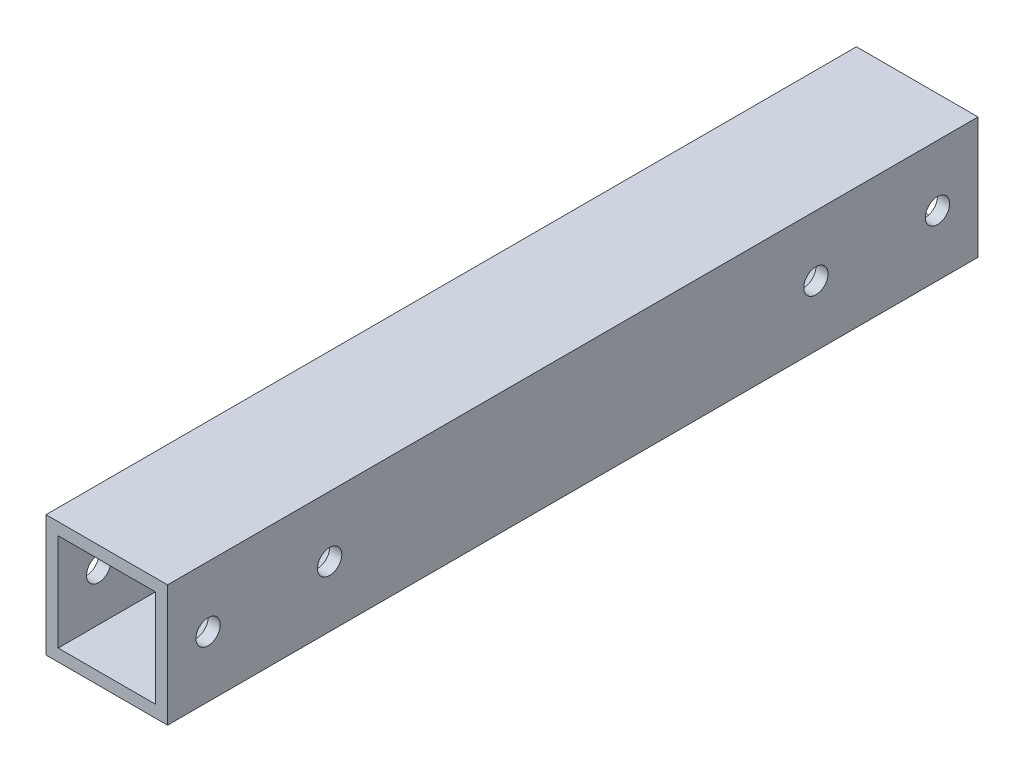
from build123d import *

# Parameters (mm, degrees)
ESQUISSE1_W             = 15
ESQUISSE1_H             = 15
EXTRUSION1_DEPTH        = 100
ESQUISSE2_W             = 12
ESQUISSE2_H             = 12
EXTRUSION2_DEPTH        = 101.560926806
ESQUISSE3_R             = 1.5
ENL_V_MAT_EXTRU_1_DEPTH = 102.396498953
ESQUISSE4_R             = 1.5
ENL_V_MAT_EXTRU_2_DEPTH = 102.396498953
ESQUISSE5_R             = 1.5
ENL_V_MAT_EXTRU_3_DEPTH = 102.396498953


with BuildPart() as part:
    # Esquisse1 → Extrusion1 (new body)
    with BuildSketch(Plane.XY):
        Rectangle(ESQUISSE1_W, ESQUISSE1_H)
    extrude(amount=EXTRUSION1_DEPTH)

    # Esquisse2 → Extrusion2 (cut, through all)
    with BuildSketch(Plane.XY.offset(100)):
        Rectangle(ESQUISSE2_W, ESQUISSE2_H)
    extrude(amount=-EXTRUSION2_DEPTH, mode=Mode.SUBTRACT)

    # Esquisse3 → Enlèv. mat.-Extru.1 (cut, through all)
    with BuildSketch(Plane(origin=(7.5, 0, 0), x_dir=(0, 0, -1), z_dir=(1, 0, 0))):
        with Locations((-5, 0)):
            Circle(ESQUISSE3_R)
    extrude(amount=-ENL_V_MAT_EXTRU_1_DEPTH, mode=Mode.SUBTRACT)

    # Esquisse4 → Enlèv. mat.-Extru.2 (cut, through all)
    with BuildSketch(Plane(origin=(7.5, 0, 0), x_dir=(0, 0, -1), z_dir=(1, 0, 0))):
        with Locations((-20, 0)):
            Circle(ESQUISSE4_R)
    extrude(amount=-ENL_V_MAT_EXTRU_2_DEPTH, mode=Mode.SUBTRACT)

    # Esquisse5 → Enlèv. mat.-Extru.3 (cut, through all)
    with BuildSketch(Plane(origin=(7.5, 0, 0), x_dir=(0, 0, -1), z_dir=(1, 0, 0))):
        with Locations((-95, 0)):
            Circle(ESQUISSE5_R)
        with Locations((-80, 0)):
            Circle(ESQUISSE5_R)
    extrude(amount=-ENL_V_MAT_EXTRU_3_DEPTH, mode=Mode.SUBTRACT)


solid = part.part
